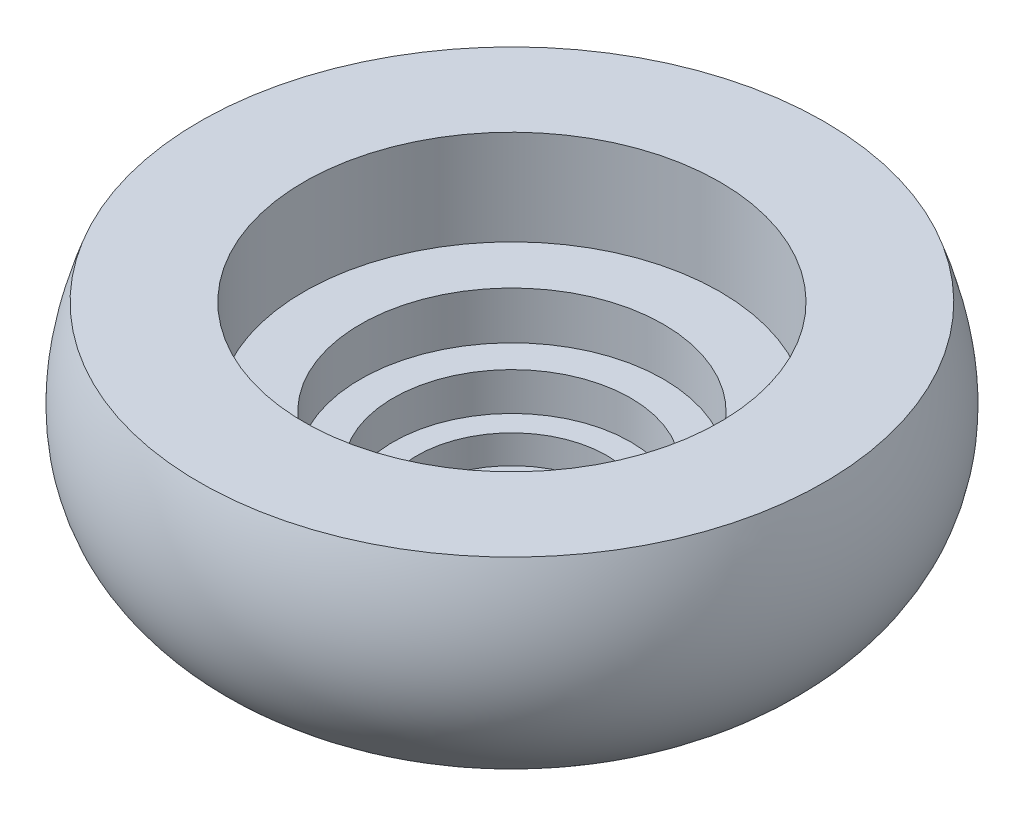
from build123d import *


with BuildPart() as part:
    # 스케치2 → 회전2 (revolve)
    with BuildSketch(Plane.XY, mode=Mode.PRIVATE) as revolve_2_sk:
        with BuildLine():
            add(Edge.make_bspline(
                [(-5, 0), (-19.422390958, 1.115775905), (-41.11480778, 7.04489841), (-32.9, 30)],
                knots=[0, 0, 0, 0, 1, 1, 1, 1], degree=3))
            Line((-32.9, 30), (-21.9, 30))
            Line((-21.9, 30), (-21.9, 20))
            Line((-21.9, 20), (-15.95, 20))
            Line((-15.95, 20), (-15.95, 15))
            Line((-15.95, 15), (-12.5, 15))
            Line((-12.5, 15), (-12.5, 11))
            Line((-12.5, 11), (-10, 11))
            Line((-10, 11), (-10, 8))
            Line((-10, 8), (0, 8))
            Line((0, 8), (0, 0))
            Line((0, 0), (-5, 0))
        make_face()
    revolve(revolve_2_sk.sketch.rotate(Axis((0, 0, 0), (0, 1, 0)), 270), axis=Axis((0, 0, 0), (0, 1, 0)))


solid = part.part
